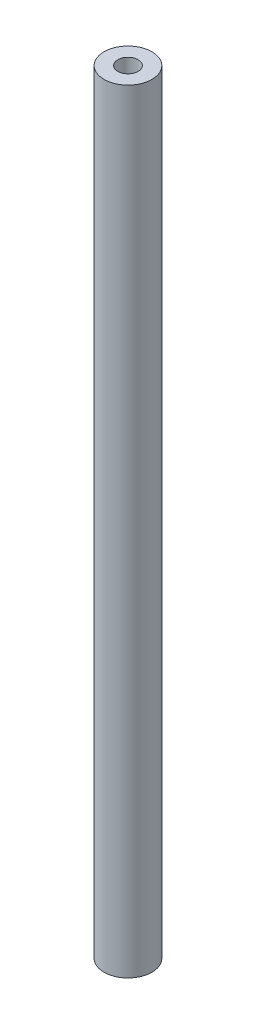
from build123d import *

# Parameters (mm, degrees)
SKETCH1_R                  = 4.7625
BOSS_EXTRUDE1_DEPTH        = 153.7335
F_10_32_TAPPED_HOLE1_D     = 4.0386
F_10_32_TAPPED_HOLE1_DEPTH = 10.16
F_10_32_TAPPED_HOLE1_TIP   = 1.213317848
F_10_32_TAPPED_HOLE2_D     = 4.0386
F_10_32_TAPPED_HOLE2_DEPTH = 11.938
F_10_32_TAPPED_HOLE2_TIP   = 1.213317848


with BuildPart() as part:
    # Sketch1 → Boss-Extrude1 (new body)
    with BuildSketch(Plane(origin=(0, 0, 0), x_dir=(1, 0, 0), z_dir=(0, 1, 0))):
        with Locations(Location((0, 0, 0), (0, 0, 270))):
            Circle(SKETCH1_R)
    extrude(amount=BOSS_EXTRUDE1_DEPTH)

    # #10-32 Tapped Hole1
    with Locations(Plane(origin=(0, 0, 0), x_dir=(-1, 0, 0), z_dir=(0, -1, 0))):
        with Locations((0, 0)):
            Hole(F_10_32_TAPPED_HOLE1_D / 2, depth=F_10_32_TAPPED_HOLE1_DEPTH)
            with Locations((0, 0, -(F_10_32_TAPPED_HOLE1_DEPTH + F_10_32_TAPPED_HOLE1_TIP / 2))):  # 118° drill point
                Cone(0, F_10_32_TAPPED_HOLE1_D / 2, F_10_32_TAPPED_HOLE1_TIP, mode=Mode.SUBTRACT)

    # #10-32 Tapped Hole2
    with Locations(Plane(origin=(0, 153.7335, 0), x_dir=(1, 0, 0), z_dir=(0, 1, 0))):
        with Locations((0, 0)):
            Hole(F_10_32_TAPPED_HOLE2_D / 2, depth=F_10_32_TAPPED_HOLE2_DEPTH)
            with Locations((0, 0, -(F_10_32_TAPPED_HOLE2_DEPTH + F_10_32_TAPPED_HOLE2_TIP / 2))):  # 118° drill point
                Cone(0, F_10_32_TAPPED_HOLE2_D / 2, F_10_32_TAPPED_HOLE2_TIP, mode=Mode.SUBTRACT)


solid = part.part
